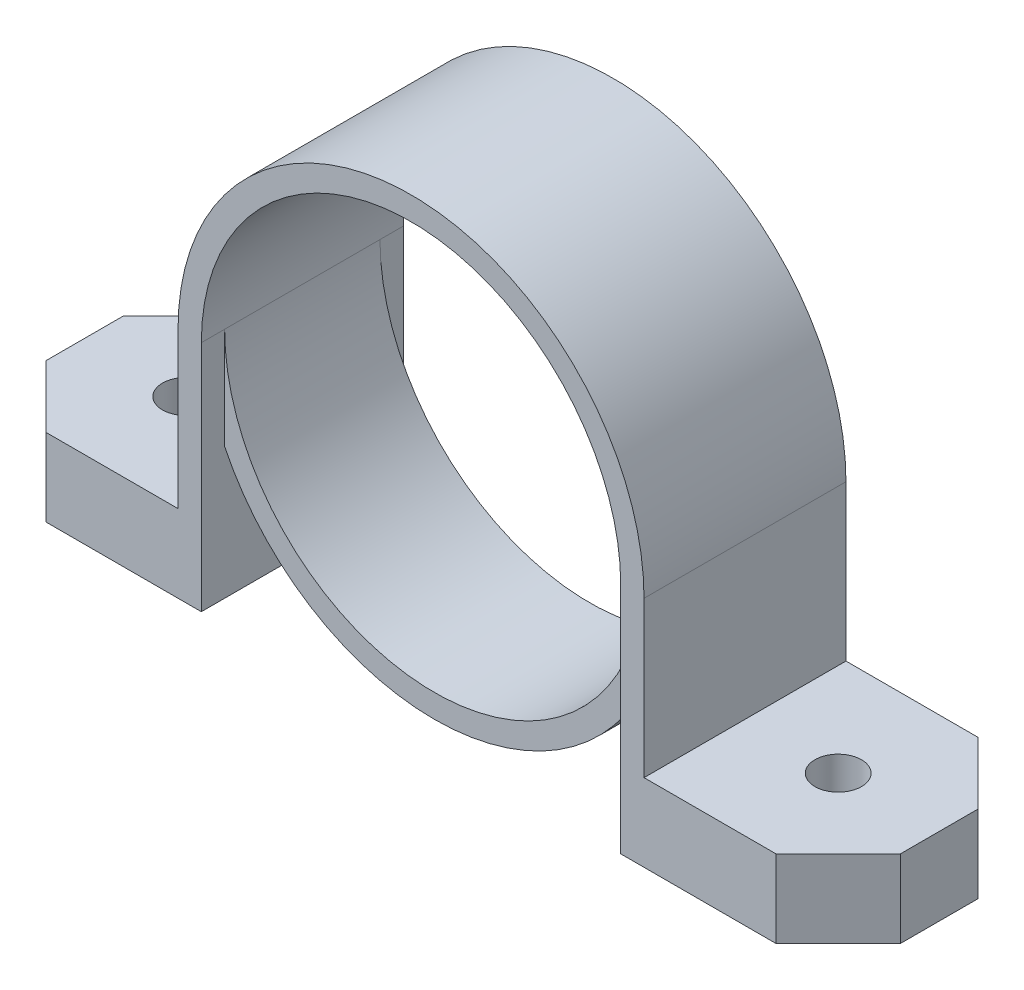
from build123d import *

# Parameters (mm, degrees)
EXTRUDE_5_DEPTH          = 6.5
EXTRUDE_5_DEPTH_BACK     = 6.5
EXTRUDE_6_DEPTH          = 5
EXTRUDE_6_DEPTH_BACK     = 5
CUT_EXTRUDE_1_DEPTH      = 42.21286207
CUT_EXTRUDE_1_DEPTH_BACK = 42.21286207
SKETCH_2_R               = 1.5


with BuildPart() as part:
    # 草图1 → 凸台-拉伸5 (new, two sides: drawn at the far end of the back side and taken through both)
    with BuildSketch(Plane.XY.offset(-EXTRUDE_5_DEPTH_BACK)):
        with BuildLine():
            ThreePointArc((15, 0), (0, 15), (-15, 0))
            Line((-15, 0), (-15, -10))
            Line((-15, -10), (-27.5, -10))
            Line((-27.5, -10), (-27.5, -15))
            Line((-27.5, -15), (-13.5, -15))
            Line((-13.5, -15), (-13.5, -6.538348415))
            Line((-13.5, -6.538348415), (-13.5, 0))
            ThreePointArc((-13.5, 0), (0, 13.5), (13.5, 0))
            Line((13.5, 0), (13.5, -6.538348415))
            Line((13.5, -6.538348415), (13.5, -15))
            Line((13.5, -15), (27.5, -15))
            Line((27.5, -15), (27.5, -10))
            Line((27.5, -10), (15, -10))
            Line((15, -10), (15, 0))
        make_face()
    extrude(amount=EXTRUDE_5_DEPTH + EXTRUDE_5_DEPTH_BACK)

    # 草图2 → 切除-拉伸1 (cut, two sides: drawn at the far end of the back side and taken through both)
    with BuildSketch(Plane.XZ.offset(15).offset(-CUT_EXTRUDE_1_DEPTH_BACK)):
        with Locations((-21, 0)):
            Circle(SKETCH_2_R)
        with Locations((21, 0)):
            Circle(SKETCH_2_R)
        Polygon((-27.5, 2.5), (-23.5, 6.5), (-27.5, 6.5), align=None)
        Polygon((-27.5, -6.5), (-23.5, -6.5), (-27.5, -2.5), align=None)
        Polygon((27.5, 6.5), (23.5, 6.5), (27.5, 2.5), align=None)
        Polygon((27.5, -2.5), (23.5, -6.5), (27.5, -6.5), align=None)
    extrude(amount=CUT_EXTRUDE_1_DEPTH + CUT_EXTRUDE_1_DEPTH_BACK, mode=Mode.SUBTRACT)


with BuildPart() as body_2:
    # 草图1<7> → 凸台-拉伸6 (new, two sides: drawn at the far end of the back side and taken through both)
    with BuildSketch(Plane.XY.offset(-EXTRUDE_6_DEPTH_BACK)):
        with BuildLine():
            ThreePointArc((-13.5, -6.538348415), (0, -15), (13.5, -6.538348415))
            Line((13.5, -6.538348415), (13.5, 0))
            ThreePointArc((13.5, 0), (0, -13.5), (-13.5, 0))
            Line((-13.5, 0), (-13.5, -6.538348415))
        make_face()
    extrude(amount=EXTRUDE_6_DEPTH + EXTRUDE_6_DEPTH_BACK)


solid = Compound([part.part, body_2.part])
